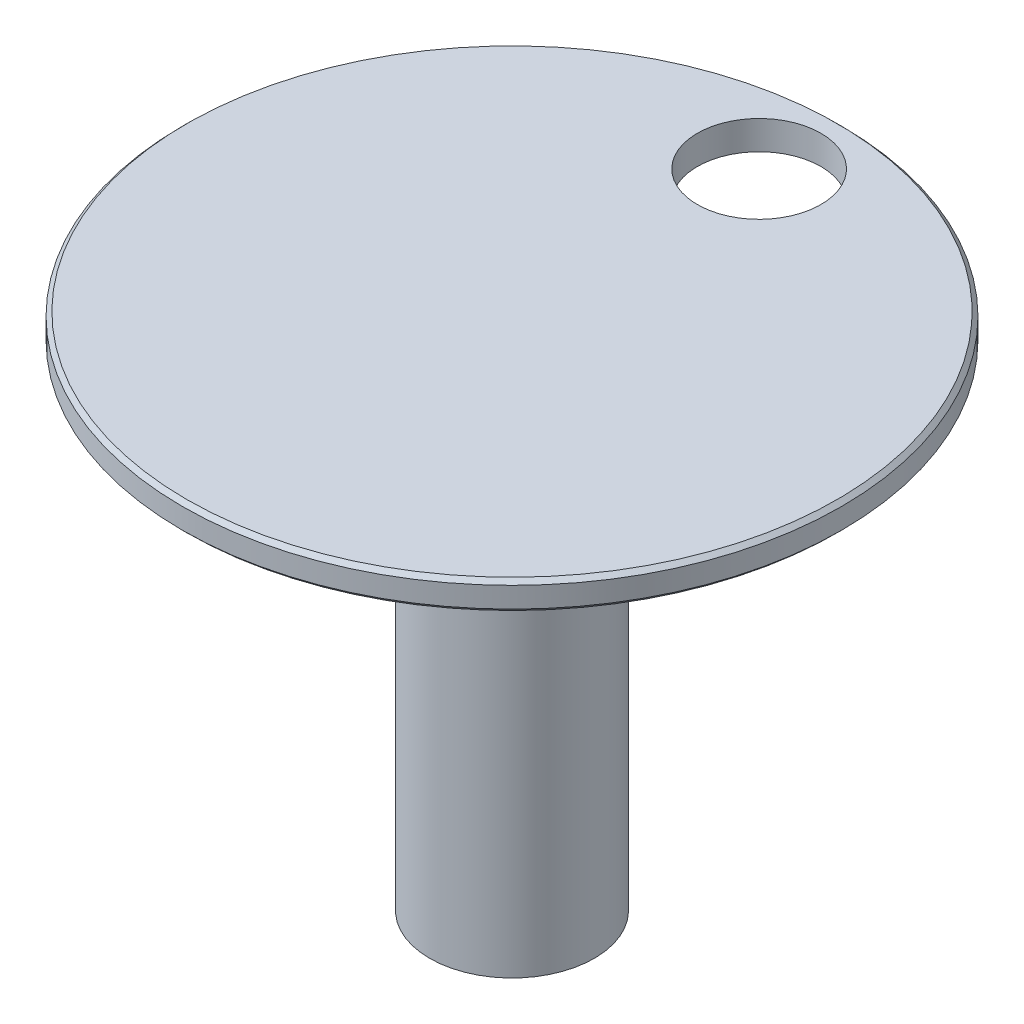
from build123d import *

# Parameters (mm, degrees)
SKETCH2_R           = 2
BOSS_EXTRUDE1_DEPTH = 11.6
SKETCH3_R           = 4
BOSS_EXTRUDE2_DEPTH = 0.3
SKETCH4_R           = 8
BOSS_EXTRUDE3_DEPTH = 0.7
SKETCH5_R           = 1.5
CUT_EXTRUDE1_DEPTH  = 8.5
SKETCH6_R           = 1.5
CUT_EXTRUDE2_DEPTH  = 17.419805115
CHAMFER1_SIZE       = 0.1


with BuildPart() as part:
    # Sketch2 → Boss-Extrude1 (new body)
    with BuildSketch(Plane(origin=(0, 0, 0), x_dir=(1, 0, 0), z_dir=(0, 1, 0))):
        with Locations(Location((0, 0, 0), (0, 0, 270))):
            Circle(SKETCH2_R)
    extrude(amount=BOSS_EXTRUDE1_DEPTH)

    # Sketch3 → Boss-Extrude2 (add)
    with BuildSketch(Plane(origin=(0, 11.6, 0), x_dir=(1, 0, 0), z_dir=(0, 1, 0))):
        with Locations(Location((0, 0, 0), (0, 0, 270))):
            Circle(SKETCH3_R)
    extrude(amount=BOSS_EXTRUDE2_DEPTH)

    # Sketch4 → Boss-Extrude3 (add)
    with BuildSketch(Plane(origin=(0, 11.9, 0), x_dir=(1, 0, 0), z_dir=(0, 1, 0))):
        with Locations(Location((0, 0, 0), (0, 0, 270))):
            Circle(SKETCH4_R)
    extrude(amount=BOSS_EXTRUDE3_DEPTH)

    # Sketch5 → Cut-Extrude1 (cut)
    with BuildSketch(Plane.XZ):
        with Locations(Location((0, 0, 0), (0, 0, 270))):
            Circle(SKETCH5_R)
    extrude(amount=-CUT_EXTRUDE1_DEPTH, mode=Mode.SUBTRACT)

    # Sketch6 → Cut-Extrude2 (cut, through all)
    with BuildSketch(Plane.XZ.offset(-11.9)):
        with Locations(Location((0, -6, 0), (0, 0, 270))):
            Circle(SKETCH6_R)
    extrude(amount=-CUT_EXTRUDE2_DEPTH, mode=Mode.SUBTRACT)

    # Chamfer1
    chamfer1_edges = [part.edges().sort_by_distance(p)[0] for p in [
        (0, 12.6, -8),
        (0, 11.9, -8),
    ]]
    chamfer(chamfer1_edges, length=CHAMFER1_SIZE)


solid = part.part
